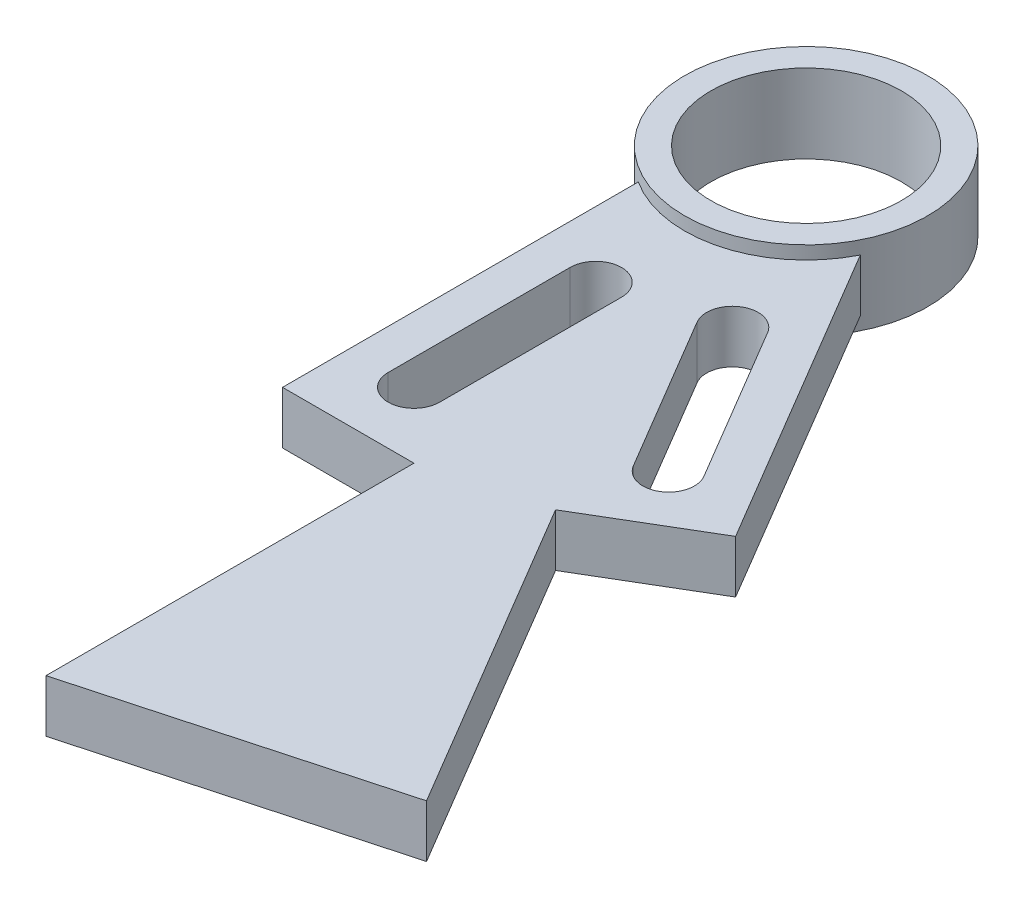
from build123d import *

# Parameters (mm, degrees)
SKETCH1_R             = 11.5062
BEARING_EXTRUDE_DEPTH = 4.7625
BOSS_EXTRUDE2_DEPTH   = 3.175


with BuildPart() as part:
    # Sketch1 → Bearing extrude (new, symmetric)
    with BuildSketch(Plane(origin=(0, 0, 0), x_dir=(1, 0, 0), z_dir=(0, 1, 0))):
        with BuildLine():
            ThreePointArc((14.6812, 0), (-7.035822924, 12.885450292), (-7.9375, -12.350454534))
            ThreePointArc((-7.9375, -12.350454534), (3.879263001, -14.159412135), (13.123952885, -6.580235111))
            ThreePointArc((13.123952885, -6.580235111), (14.286584801, -3.380995145), (14.6812, 0))
        make_face()
        Circle(SKETCH1_R, mode=Mode.SUBTRACT)
    extrude(amount=BEARING_EXTRUDE_DEPTH, both=True)

    # Sketch1<5> → Boss-Extrude2 (add, symmetric)
    with BuildSketch(Plane(origin=(0, 0, 0), x_dir=(1, 0, 0), z_dir=(0, 1, 0))):
        with BuildLine():
            Line((-7.9375, -12.350454534), (-7.9375, -55.3212))
            Line((-7.9375, -55.3212), (7.9375, -55.3212))
            Line((7.9375, -55.3212), (7.9375, -99.7712))
            Line((7.9375, -99.7712), (44.02270421, -89.884914027))
            Line((44.02270421, -89.884914027), (21.367233075, -51.641847628))
            Line((21.367233075, -51.641847628), (28.196352075, -47.596227782))
            Line((28.196352075, -47.596227782), (35.025471075, -43.550607937))
            Line((35.025471075, -43.550607937), (13.123952885, -6.580235111))
            ThreePointArc((13.123952885, -6.580235111), (3.879263001, -14.159412135), (-7.9375, -12.350454534))
        make_face()
        with BuildLine():
            ThreePointArc((3.1115, -47.3837), (0, -50.4952), (-3.1115, -47.3837))
            Line((-3.1115, -47.3837), (-3.1115, -25.4127))
            ThreePointArc((-3.1115, -25.4127), (0, -22.3012), (3.1115, -25.4127))
            Line((3.1115, -25.4127), (3.1115, -47.3837))
        make_face(mode=Mode.SUBTRACT)
        with BuildLine():
            ThreePointArc((26.827746878, -39.181225803), (27.16505605, -41.538655384), (25.736615209, -43.44412343))
            ThreePointArc((25.736615209, -43.44412343), (23.379185628, -43.781432602), (21.473717582, -42.352991762))
            Line((21.473717582, -42.352991762), (10.275441849, -23.44999037))
            ThreePointArc((10.275441849, -23.44999037), (11.366573518, -19.187092742), (15.629471145, -20.278224411))
            Line((15.629471145, -20.278224411), (26.827746878, -39.181225803))
        make_face(mode=Mode.SUBTRACT)
    extrude(amount=BOSS_EXTRUDE2_DEPTH, both=True)


solid = part.part
